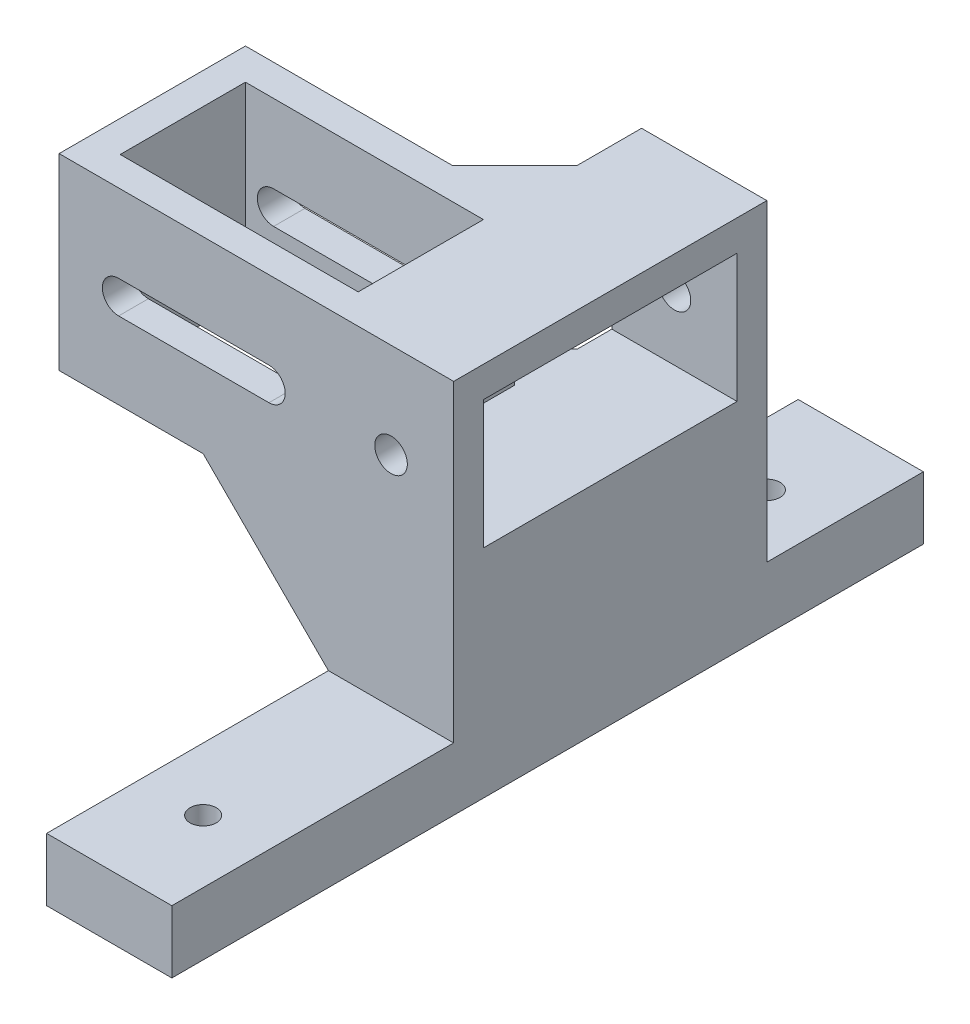
from build123d import *

# Parameters (mm, degrees)
SKETCH4_W           = 20
SKETCH4_H           = 120
BOSS_EXTRUDE4_DEPTH = 10
SKETCH5_R           = 2.1
CUT_EXTRUDE1_DEPTH  = 10
SKETCH6_W           = 20
SKETCH6_H           = 50
BOSS_EXTRUDE5_DEPTH = 50
SKETCH7_W           = 40.5
SKETCH7_H           = 20.5
CUT_EXTRUDE2_DEPTH  = 20
SKETCH8_R           = 2.6
CUT_EXTRUDE3_DEPTH  = 50
SKETCH9_W           = 4.75
SKETCH9_H           = 30
SKETCH9_W_2         = 5
BOSS_EXTRUDE6_DEPTH = 40
CUT_EXTRUDE4_DEPTH  = 40
BOSS_EXTRUDE7_START = -29.75
SKETCH11_W          = 5
SKETCH11_H          = 30
BOSS_EXTRUDE7_DEPTH = 29.75
SKETCH12_R          = 2.1
CUT_EXTRUDE5_DEPTH  = 5
CHAMFER1_SIZE       = 20
CHAMFER2_SIZE       = 10


with BuildPart() as part:
    # Sketch4 → Boss-Extrude4 (new body)
    with BuildSketch(Plane(origin=(0, 0, 0), x_dir=(1, 0, 0), z_dir=(0, 1, 0))):
        with Locations((10, 60)):
            Rectangle(SKETCH4_W, SKETCH4_H)
    extrude(amount=BOSS_EXTRUDE4_DEPTH)

    # Sketch5 → Cut-Extrude1 (cut)
    with BuildSketch(Plane(origin=(0, 10, 0), x_dir=(1, 0, 0), z_dir=(0, 1, 0))):
        with Locations(Location((10, 105, 0), (0, 0, 270))):
            Circle(SKETCH5_R)
        with Locations(Location((10, 15, 0), (0, 0, 270))):
            Circle(SKETCH5_R)
    extrude(amount=-CUT_EXTRUDE1_DEPTH, mode=Mode.SUBTRACT)

    # Sketch6 → Boss-Extrude5 (add)
    with BuildSketch(Plane(origin=(0, 10, 0), x_dir=(1, 0, 0), z_dir=(0, 1, 0))):
        with Locations((10, 70)):
            Rectangle(SKETCH6_W, SKETCH6_H)
    extrude(amount=BOSS_EXTRUDE5_DEPTH)

    # Sketch7 → Cut-Extrude2 (cut)
    with BuildSketch(Plane.ZY):
        with Locations((-70, 44.85)):
            Rectangle(SKETCH7_W, SKETCH7_H)
    extrude(amount=-CUT_EXTRUDE2_DEPTH, mode=Mode.SUBTRACT)

    # Sketch8 → Cut-Extrude3 (cut, symmetric)
    with BuildSketch(Plane.XY.offset(-90.25)):
        with Locations((10, 44.85)):
            Circle(SKETCH8_R)
    extrude(amount=CUT_EXTRUDE3_DEPTH, both=True, mode=Mode.SUBTRACT)

    # Sketch9 → Boss-Extrude6 (add)
    with BuildSketch(Plane.ZY):
        with Locations((-47.375, 45)):
            Rectangle(SKETCH9_W, SKETCH9_H)
        with Locations((-72.25, 45)):
            Rectangle(SKETCH9_W_2, SKETCH9_H)
    extrude(amount=BOSS_EXTRUDE6_DEPTH)

    # Sketch10 → Cut-Extrude4 (cut)
    with BuildSketch(Plane(origin=(0, 0, -74.75), x_dir=(-1, 0, 0), z_dir=(0, 0, -1))):
        with BuildLine():
            Line((33.5, 42.3), (9.5, 42.3))
            ThreePointArc((9.5, 42.3), (6.9, 44.9), (9.5, 47.5))
            Line((9.5, 47.5), (33.5, 47.5))
            ThreePointArc((33.5, 47.5), (36.1, 44.9), (33.5, 42.3))
        make_face()
    extrude(amount=-CUT_EXTRUDE4_DEPTH, mode=Mode.SUBTRACT)

    # Sketch11 → Boss-Extrude7 (add)
    with BuildSketch(Plane(origin=(0, 0, -74.75), x_dir=(-1, 0, 0), z_dir=(0, 0, -1)).offset(BOSS_EXTRUDE7_START)):
        with Locations((40.5, 45)):
            Rectangle(SKETCH11_W, SKETCH11_H)
    extrude(amount=BOSS_EXTRUDE7_DEPTH)

    # Sketch12 → Cut-Extrude5 (cut)
    with BuildSketch(Plane.ZY.offset(43)):
        with Locations((-59.875, 45)):
            Circle(SKETCH12_R)
    extrude(amount=-CUT_EXTRUDE5_DEPTH, mode=Mode.SUBTRACT)

    # Chamfer1
    chamfer1_edges = [part.edges().sort_by_distance(p)[0] for p in [
        (0, 30, -47.375),
        (0, 30, -72.25),
    ]]
    chamfer(chamfer1_edges, length=CHAMFER1_SIZE)

    # Chamfer2
    chamfer2_edges = [part.edges().sort_by_distance(p)[0] for p in [
        (0, 57.55, -74.75),
        (0, 22.3, -74.75),
    ]]
    chamfer(chamfer2_edges, length=CHAMFER2_SIZE)


solid = part.part
